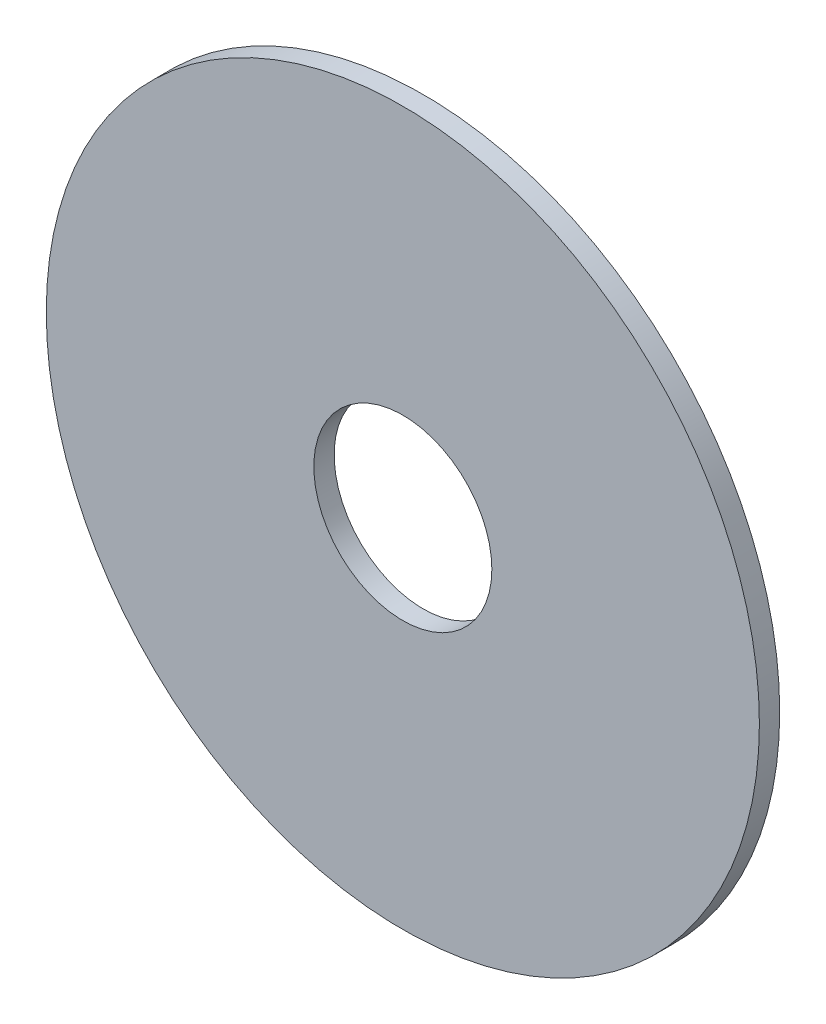
from build123d import *

# Parameters (mm, degrees)
SKETCH1_R           = 25.435
SKETCH1_R_2         = 6.35
BOSS_EXTRUDE1_DEPTH = 0.725


with BuildPart() as part:
    # Sketch1 → Boss-Extrude1 (new, symmetric)
    with BuildSketch(Plane.XY):
        Circle(SKETCH1_R)
        Circle(SKETCH1_R_2, mode=Mode.SUBTRACT)
    extrude(amount=BOSS_EXTRUDE1_DEPTH, both=True)


solid = part.part
